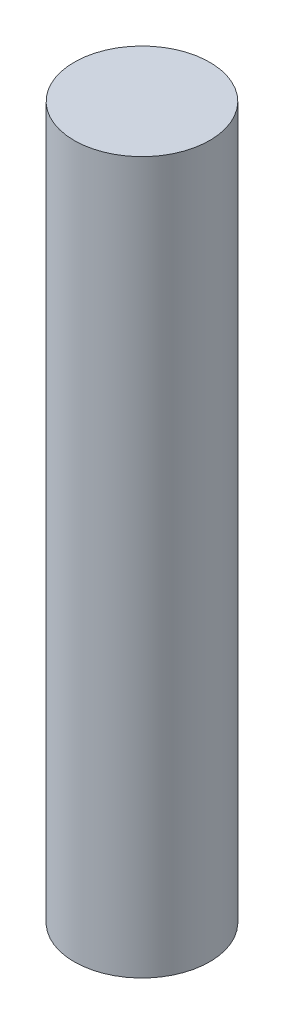
from build123d import *

# Parameters (mm, degrees)
SKETCH1_R           = 0.89
BOSS_EXTRUDE1_DEPTH = 9.34


with BuildPart() as part:
    # Sketch1 → Boss-Extrude1 (new body)
    with BuildSketch(Plane(origin=(0, 0, 0), x_dir=(1, 0, 0), z_dir=(0, 1, 0))):
        with Locations(Location((0, 0, 0), (0, 0, 270))):
            Circle(SKETCH1_R)
    extrude(amount=BOSS_EXTRUDE1_DEPTH)


solid = part.part
